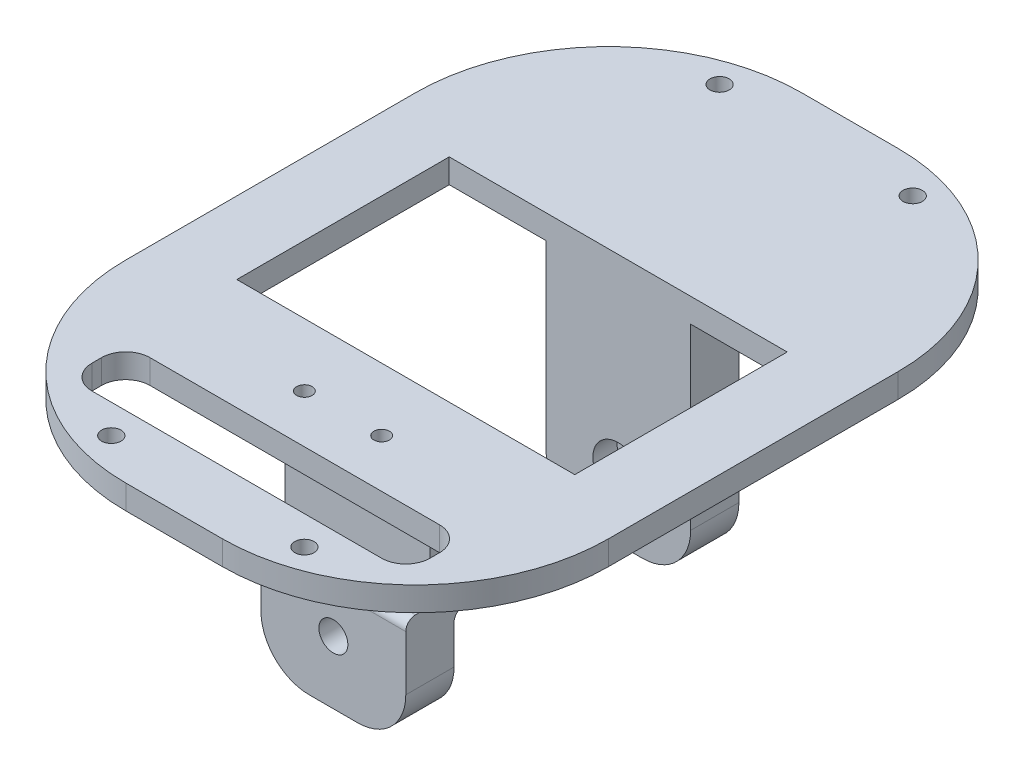
from build123d import *

# Parameters (mm, degrees)
SKETCH1_W           = 100
SKETCH1_H           = 90
BOSS_EXTRUDE1_DEPTH = 5
SKETCH2_W           = 70
SKETCH2_H           = 44
CUT_EXTRUDE1_DEPTH  = 68.453687816
SKETCH3_R           = 1.6
CUT_EXTRUDE2_DEPTH  = 68.453687816
SKETCH4_W           = 100
SKETCH4_H           = 25
BOSS_EXTRUDE2_DEPTH = 5
SKETCH6_W           = 70
SKETCH6_H           = 12
CUT_EXTRUDE4_DEPTH  = 17
SKETCH8_W           = 30
SKETCH8_H           = 10
BOSS_EXTRUDE4_DEPTH = 47
SKETCH11_R          = 5.25
CUT_EXTRUDE5_DEPTH  = 5
SKETCH12_R          = 3
CUT_EXTRUDE6_DEPTH  = 5
FILLET1_R           = 10
CUT_EXTRUDE7_START  = -5
SKETCH13_R          = 5.25
CUT_EXTRUDE7_DEPTH  = 5
CUT_EXTRUDE8_START  = -5
SKETCH14_R          = 3
CUT_EXTRUDE8_DEPTH  = 5
FILLET2_R           = 10
SKETCH15_R          = 2
CUT_EXTRUDE9_DEPTH  = 101.518654985
FILLET3_R           = 40
FILLET4_R           = 40
FILLET5_R           = 5
BOSS_EXTRUDE5_DEPTH = 30
SKETCH17_R          = 5.25
CUT_EXTRUDE10_DEPTH = 10
SKETCH18_R          = 3
CUT_EXTRUDE12_DEPTH = 21
CUT_EXTRUDE13_DEPTH = 21
SKETCH20_W          = 5
SKETCH20_H          = 20
CUT_EXTRUDE14_DEPTH = 107.46126056
FILLET6_R           = 2
FILLET7_R           = 2


with BuildPart() as part:
    # Sketch1 → Boss-Extrude1 (new body)
    with BuildSketch(Plane(origin=(0, 0, 0), x_dir=(1, 0, 0), z_dir=(0, 1, 0))):
        Rectangle(SKETCH1_W, SKETCH1_H)
    extrude(amount=BOSS_EXTRUDE1_DEPTH)

    # Sketch2 → Cut-Extrude1 (cut, through all)
    with BuildSketch(Plane(origin=(0, 5, 0), x_dir=(1, 0, 0), z_dir=(0, 1, 0))):
        Rectangle(SKETCH2_W, SKETCH2_H)
    extrude(amount=-CUT_EXTRUDE1_DEPTH, mode=Mode.SUBTRACT)

    # Sketch3 → Cut-Extrude2 (cut, through all)
    with BuildSketch(Plane(origin=(0, 5, 0), x_dir=(1, 0, 0), z_dir=(0, 1, 0))):
        with Locations(Location((-8, -35, 0), (0, 0, 270))):
            Circle(SKETCH3_R)
        with Locations(Location((8, -35, 0), (0, 0, 90))):
            Circle(SKETCH3_R)
    extrude(amount=-CUT_EXTRUDE2_DEPTH, mode=Mode.SUBTRACT)

    # Sketch4 → Boss-Extrude2 (add)
    with BuildSketch(Plane(origin=(0, 5, 0), x_dir=(1, 0, 0), z_dir=(0, 1, 0))):
        with Locations((0, -57.5)):
            Rectangle(SKETCH4_W, SKETCH4_H)
        with Locations((0, 57.5)):
            Rectangle(SKETCH4_W, SKETCH4_H)
    extrude(amount=-BOSS_EXTRUDE2_DEPTH)

    # Sketch6 → Cut-Extrude4 (cut)
    with BuildSketch(Plane(origin=(0, 5, 0), x_dir=(1, 0, 0), z_dir=(0, 1, 0))):
        with Locations((0, -51)):
            Rectangle(SKETCH6_W, SKETCH6_H)
    extrude(amount=-CUT_EXTRUDE4_DEPTH, mode=Mode.SUBTRACT)

    # Sketch8 → Boss-Extrude4 (add)
    with BuildSketch(Plane.XZ):
        with Locations((0, 27)):
            Rectangle(SKETCH8_W, SKETCH8_H)
        with Locations((0, -27)):
            Rectangle(SKETCH8_W, SKETCH8_H)
    extrude(amount=BOSS_EXTRUDE4_DEPTH)

    # Sketch11 → Cut-Extrude5 (cut)
    with BuildSketch(Plane(origin=(0, 0, 22), x_dir=(-1, 0, 0), z_dir=(0, 0, -1))):
        with Locations((0, -34)):
            Circle(SKETCH11_R)
    extrude(amount=-CUT_EXTRUDE5_DEPTH, mode=Mode.SUBTRACT)

    # Sketch12 → Cut-Extrude6 (cut)
    with BuildSketch(Plane(origin=(0, 0, 27), x_dir=(-1, 0, 0), z_dir=(0, 0, -1))):
        with Locations((0, -34)):
            Circle(SKETCH12_R)
    extrude(amount=-CUT_EXTRUDE6_DEPTH, mode=Mode.SUBTRACT)

    # Fillet1
    fillet1_edges = [part.edges().sort_by_distance(p)[0] for p in [
        (-15, -47, 27),
        (15, -47, 27),
    ]]
    fillet(fillet1_edges, radius=FILLET1_R)

    # Sketch13 → Cut-Extrude7 (cut)
    with BuildSketch(Plane.XY.offset(-22).offset(CUT_EXTRUDE7_START)):
        with Locations(Location((0, -34, 0), (0, 0, 180))):
            Circle(SKETCH13_R)
    extrude(amount=CUT_EXTRUDE7_DEPTH, mode=Mode.SUBTRACT)

    # Sketch14 → Cut-Extrude8 (cut)
    with BuildSketch(Plane.XY.offset(-27).offset(CUT_EXTRUDE8_START)):
        with Locations(Location((0, -34, 0), (0, 0, 180))):
            Circle(SKETCH14_R)
    extrude(amount=CUT_EXTRUDE8_DEPTH, mode=Mode.SUBTRACT)

    # Fillet2
    fillet2_edges = [part.edges().sort_by_distance(p)[0] for p in [
        (15, -47, -27),
        (-15, -47, -27),
    ]]
    fillet(fillet2_edges, radius=FILLET2_R)

    # Sketch15 → Cut-Extrude9 (cut, through all)
    with BuildSketch(Plane(origin=(0, 5, 0), x_dir=(1, 0, 0), z_dir=(0, 1, 0))):
        with Locations(Location((-20, -63, 0), (0, 0, 270))):
            Circle(SKETCH15_R)
        with Locations(Location((-20, 63, 0), (0, 0, 270))):
            Circle(SKETCH15_R)
        with Locations(Location((20, -63, 0), (0, 0, 270))):
            Circle(SKETCH15_R)
        with Locations(Location((20, 63, 0), (0, 0, 270))):
            Circle(SKETCH15_R)
    extrude(amount=-CUT_EXTRUDE9_DEPTH, mode=Mode.SUBTRACT)

    # Fillet3
    fillet3_edges = [part.edges().sort_by_distance(p)[0] for p in [
        (-50, 2.5, 70),
        (50, 2.5, 70),
    ]]
    fillet(fillet3_edges, radius=FILLET3_R)

    # Fillet4
    fillet4_edges = [part.edges().sort_by_distance(p)[0] for p in [
        (-50, 2.5, -70),
        (50, 2.5, -70),
    ]]
    fillet(fillet4_edges, radius=FILLET4_R)

    # Fillet5
    fillet5_edges = [part.edges().sort_by_distance(p)[0] for p in [
        (-35, 2.5, 57),
        (-35, 2.5, 45),
        (35, 2.5, 45),
        (35, 2.5, 57),
    ]]
    fillet(fillet5_edges, radius=FILLET5_R)

    # Sketch16 → Boss-Extrude5 (add)
    with BuildSketch(Plane(origin=(15, 0, 0), x_dir=(0, 0, -1), z_dir=(1, 0, 0))):
        Polygon((-32, -23.652392467), (-37, -23.652392467), (-37, -47), (-27, -47), (-27, -23.652392467), align=None)
    extrude(amount=-BOSS_EXTRUDE5_DEPTH)

    # Sketch17 → Cut-Extrude10 (cut)
    with BuildSketch(Plane(origin=(0, 0, 22), x_dir=(-1, 0, 0), z_dir=(0, 0, -1))):
        with Locations((0, -34)):
            Circle(SKETCH17_R)
    extrude(amount=-CUT_EXTRUDE10_DEPTH, mode=Mode.SUBTRACT)

    # Sketch18 → Cut-Extrude12 (cut)
    with BuildSketch(Plane(origin=(0, 0, 22), x_dir=(-1, 0, 0), z_dir=(0, 0, -1))):
        with Locations(Location((0, -34, 0), (0, 0, 180))):
            Circle(SKETCH18_R)
    extrude(amount=-CUT_EXTRUDE12_DEPTH, mode=Mode.SUBTRACT)

    # Sketch19 → Cut-Extrude13 (cut)
    with BuildSketch(Plane(origin=(0, 0, 22), x_dir=(-1, 0, 0), z_dir=(0, 0, -1))):
        with BuildLine():
            Line((-15, -37), (-15, -47))
            Line((-15, -47), (-5, -47))
            ThreePointArc((-5, -47), (-12.071067812, -44.071067812), (-15, -37))
        make_face()
        with BuildLine():
            Line((5, -47), (15, -47))
            Line((15, -47), (15, -37))
            ThreePointArc((15, -37), (12.071067812, -44.071067812), (5, -47))
        make_face()
    extrude(amount=-CUT_EXTRUDE13_DEPTH, mode=Mode.SUBTRACT)

    # Sketch20 → Cut-Extrude14 (cut, through all)
    with BuildSketch(Plane(origin=(15, 0, 0), x_dir=(0, 0, -1), z_dir=(1, 0, 0))):
        with Locations((-24.5, -37)):
            Rectangle(SKETCH20_W, SKETCH20_H)
    extrude(amount=-CUT_EXTRUDE14_DEPTH, mode=Mode.SUBTRACT)

    # Fillet6
    fillet6_edges = [part.edges().sort_by_distance(p)[0] for p in [
        (0, -23.652392467, 32),
        (0, -23.652392467, 37),
    ]]
    fillet(fillet6_edges, radius=FILLET6_R)

    # Fillet7
    fillet7_edges = [part.edges().sort_by_distance(p)[0] for p in [
        (0, -27, 27),
        (0, -27, 22),
    ]]
    fillet(fillet7_edges, radius=FILLET7_R)


solid = part.part
